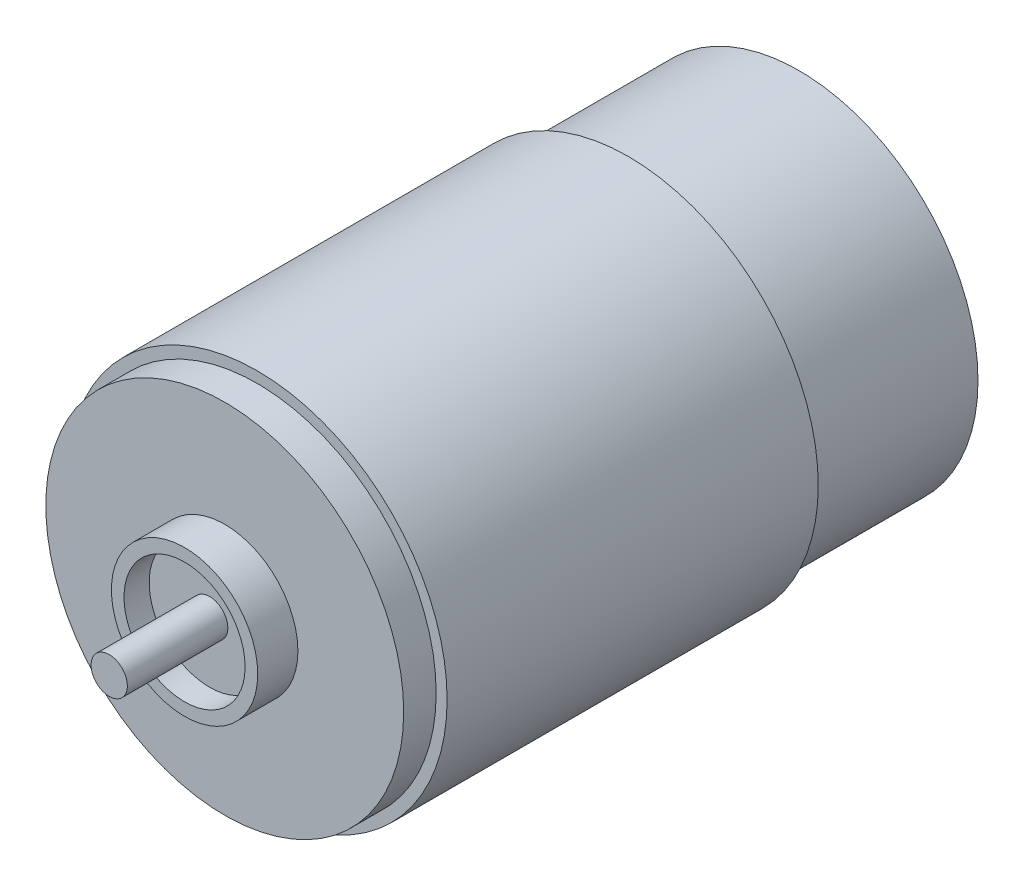
from build123d import *

# Parameters (mm, degrees)
SKETCH_1_R          = 18.9
EXTRUDE_1_DEPTH     = 36.94
SKETCH_2_R          = 17.81
EXTRUDE_2_DEPTH     = 3.23
EXTRUDE_START       = 16.99
SKETCH_3_R          = 17.81
EXTRUDE_3_DEPTH     = 16.99
SKETCH_4_R          = 16.485
CUT_EXTRUDE_1_DEPTH = 1.38
SKETCH_5_R          = 12.15
EXTRUDE_4_DEPTH     = 1
SKETCH_6_R          = 5.125
EXTRUDE_5_DEPTH     = 4
SKETCH_7_R          = 4.49987444
CUT_EXTRUDE_2_DEPTH = 1
SKETCH_8_R          = 1.275207664
EXTRUDE_6_DEPTH     = 4
SKETCH_9_R          = 7.280511115
EXTRUDE_7_DEPTH     = 4
SKETCH_10_R         = 6.024089917
CUT_EXTRUDE_3_DEPTH = 2.5
SKETCH_11_R         = 1.805272954
EXTRUDE_9_DEPTH     = 10


with BuildPart() as part:
    # 草图1 → 凸台-拉伸1 (new body)
    with BuildSketch(Plane.XY):
        Circle(SKETCH_1_R)
    extrude(amount=EXTRUDE_1_DEPTH)

    # 草图2 → 凸台-拉伸2 (add)
    with BuildSketch(Plane.XY.offset(36.94)):
        Circle(SKETCH_2_R)
    extrude(amount=EXTRUDE_2_DEPTH)

    # 草图3 → 凸台-拉伸3 (add)
    with BuildSketch(Plane(origin=(0, 0, 0), x_dir=(-1, 0, 0), z_dir=(0, 0, -1)).offset(EXTRUDE_START)):
        with Locations(Location((0, 0, 0), (0, 0, 180))):
            Circle(SKETCH_3_R)
    extrude(amount=-EXTRUDE_3_DEPTH)

    # 草图4 → 切除-拉伸1 (cut)
    with BuildSketch(Plane(origin=(0, 0, -16.99), x_dir=(-1, 0, 0), z_dir=(0, 0, -1))):
        Circle(SKETCH_4_R)
    extrude(amount=-CUT_EXTRUDE_1_DEPTH, mode=Mode.SUBTRACT)

    # 草图5 → 凸台-拉伸4 (add)
    with BuildSketch(Plane(origin=(0, 0, -15.61), x_dir=(-1, 0, 0), z_dir=(0, 0, -1))):
        Circle(SKETCH_5_R)
    extrude(amount=EXTRUDE_4_DEPTH)

    # 草图6 → 凸台-拉伸5 (add)
    with BuildSketch(Plane(origin=(0, 0, -16.61), x_dir=(-1, 0, 0), z_dir=(0, 0, -1))):
        Circle(SKETCH_6_R)
    extrude(amount=EXTRUDE_5_DEPTH)

    # 草图7 → 切除-拉伸2 (cut)
    with BuildSketch(Plane(origin=(0, 0, -20.61), x_dir=(-1, 0, 0), z_dir=(0, 0, -1))):
        Circle(SKETCH_7_R)
    extrude(amount=-CUT_EXTRUDE_2_DEPTH, mode=Mode.SUBTRACT)

    # 草图8 → 凸台-拉伸6 (add)
    with BuildSketch(Plane(origin=(0, 0, -19.61), x_dir=(-1, 0, 0), z_dir=(0, 0, -1))):
        Circle(SKETCH_8_R)
    extrude(amount=EXTRUDE_6_DEPTH)

    # 草图9 → 凸台-拉伸7 (add)
    with BuildSketch(Plane.XY.offset(40.17)):
        Circle(SKETCH_9_R)
    extrude(amount=EXTRUDE_7_DEPTH)

    # 草图10 → 切除-拉伸3 (cut)
    with BuildSketch(Plane.XY.offset(44.17)):
        Circle(SKETCH_10_R)
    extrude(amount=-CUT_EXTRUDE_3_DEPTH, mode=Mode.SUBTRACT)

    # 草图11 → 凸台-拉伸9 (add)
    with BuildSketch(Plane.XY.offset(41.67)):
        Circle(SKETCH_11_R)
    extrude(amount=EXTRUDE_9_DEPTH)


solid = part.part
